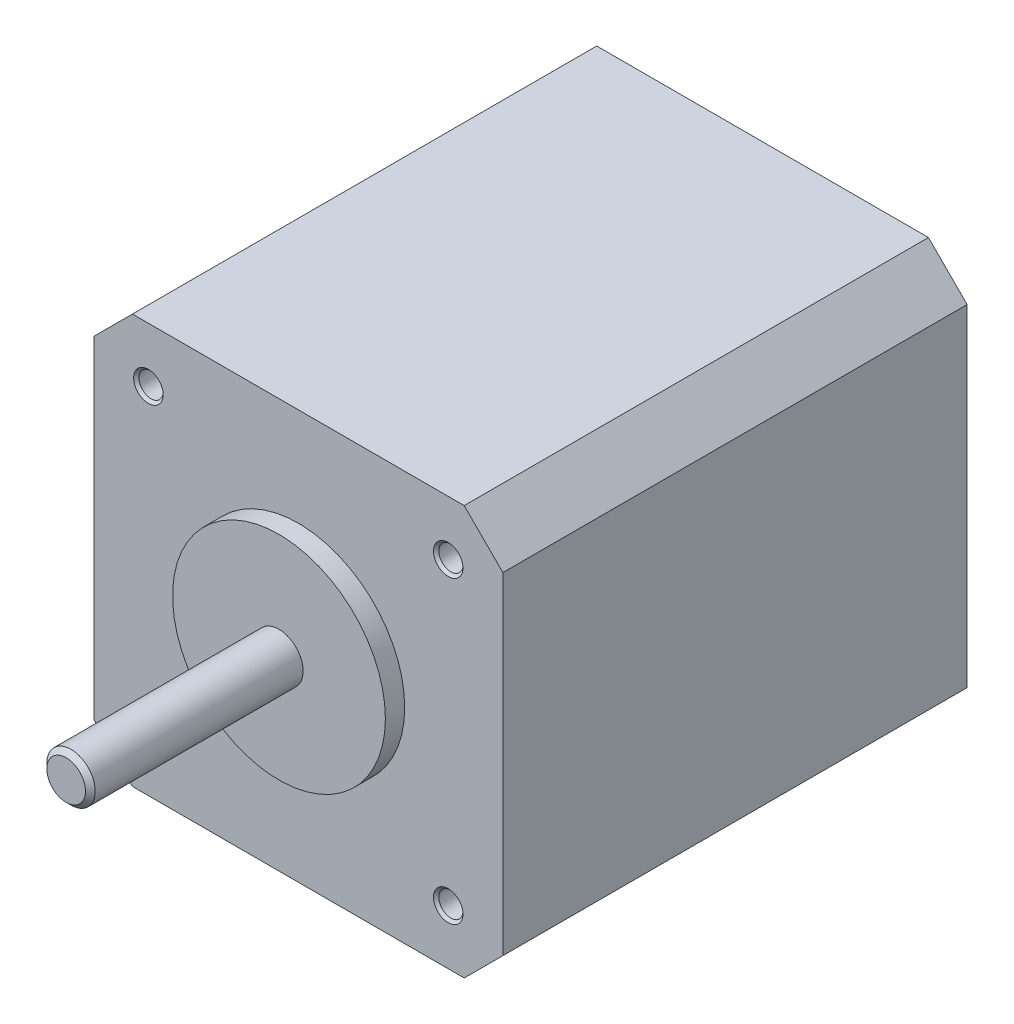
from build123d import *

# Parameters (mm, degrees)
SKETCH1_W                   = 42.3
SKETCH1_H                   = 42.3
BOSS_EXTRUDE1_DEPTH         = 48
SKETCH2_R                   = 11
BOSS_EXTRUDE2_DEPTH         = 2
SKETCH3_R                   = 2.5
BOSS_EXTRUDE3_DEPTH         = 22
CHAMFER1_SIZE               = 0.5
CHAMFER2_SIZE               = 4
M3_TAPPED_HOLE1_D           = 2.5
M3_TAPPED_HOLE1_DEPTH       = 4.5
M3_TAPPED_HOLE1_CSINK_D     = 3.05
M3_TAPPED_HOLE1_CSINK_ANGLE = 90
M3_TAPPED_HOLE1_TIP         = 0.751075774
SKETCH5_R                   = 2.5
BOSS_EXTRUDE4_DEPTH         = 10


with BuildPart() as part:
    # Sketch1 → Boss-Extrude1 (new body)
    with BuildSketch(Plane.XY):
        Rectangle(SKETCH1_W, SKETCH1_H)
    extrude(amount=BOSS_EXTRUDE1_DEPTH)

    # Sketch2 → Boss-Extrude2 (add)
    with BuildSketch(Plane.XY.offset(48)):
        Circle(SKETCH2_R)
    extrude(amount=BOSS_EXTRUDE2_DEPTH)

    # Sketch3 → Boss-Extrude3 (add)
    with BuildSketch(Plane.XY.offset(50)):
        Circle(SKETCH3_R)
    extrude(amount=BOSS_EXTRUDE3_DEPTH)

    # Chamfer1
    chamfer1_edges = [part.edges().sort_by_distance(p)[0] for p in [
        (-2.5, 0, 72),
    ]]
    chamfer(chamfer1_edges, length=CHAMFER1_SIZE)

    # Chamfer2
    chamfer2_edges = [part.edges().sort_by_distance(p)[0] for p in [
        (-21.15, 21.15, 24),
        (21.15, 21.15, 24),
        (21.15, -21.15, 24),
        (-21.15, -21.15, 24),
    ]]
    chamfer(chamfer2_edges, length=CHAMFER2_SIZE)

    # M3 Tapped Hole1
    with Locations(Plane(origin=(-15.5, 15.5, 48), x_dir=(1, 0, 0), z_dir=(0, 0, 1))):
        with Locations((0, 0), (31, 0), (31, -31), (0, -31)):
            CounterSinkHole(M3_TAPPED_HOLE1_D / 2, M3_TAPPED_HOLE1_CSINK_D / 2, depth=M3_TAPPED_HOLE1_DEPTH, counter_sink_angle=M3_TAPPED_HOLE1_CSINK_ANGLE)
            with Locations((0, 0, -(M3_TAPPED_HOLE1_DEPTH + M3_TAPPED_HOLE1_TIP / 2))):  # 118° drill point
                Cone(0, M3_TAPPED_HOLE1_D / 2, M3_TAPPED_HOLE1_TIP, mode=Mode.SUBTRACT)

    # Sketch5 → Boss-Extrude4 (add)
    with BuildSketch(Plane.XZ.offset(21.15)):
        with Locations(Location((0, 8, 0), (0, 0, 90))):
            Circle(SKETCH5_R)
    extrude(amount=BOSS_EXTRUDE4_DEPTH)


solid = part.part
